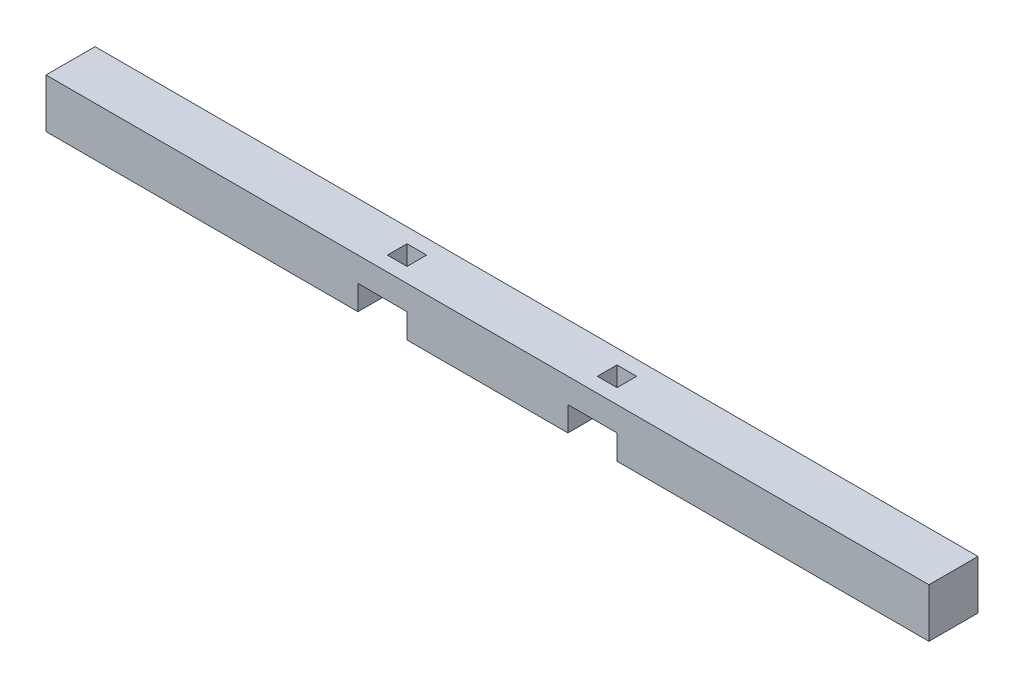
from build123d import *

# Parameters (mm, degrees)
SKETCH1_W           = 25
SKETCH1_H           = 25
BOSS_EXTRUDE1_DEPTH = 450
SKETCH2_W           = 10
SKETCH2_H           = 10
CUT_EXTRUDE1_DEPTH  = 452.386752132
SKETCH3_W           = 25
SKETCH3_H           = 25
CUT_EXTRUDE2_DEPTH  = 12.5


with BuildPart() as part:
    # Sketch1 → Boss-Extrude1 (new body)
    with BuildSketch(Plane(origin=(0, 0, 0), x_dir=(0, 0, -1), z_dir=(1, 0, 0))):
        with Locations((12.5, 12.5)):
            Rectangle(SKETCH1_W, SKETCH1_H)
    extrude(amount=BOSS_EXTRUDE1_DEPTH)

    # Sketch2 → Cut-Extrude1 (cut, through all)
    with BuildSketch(Plane(origin=(0, 25, 0), x_dir=(1, 0, 0), z_dir=(0, 1, 0))):
        with Locations((278.5, 12.5)):
            Rectangle(SKETCH2_W, SKETCH2_H)
        with Locations((171.5, 12.5)):
            Rectangle(SKETCH2_W, SKETCH2_H)
    extrude(amount=-CUT_EXTRUDE1_DEPTH, mode=Mode.SUBTRACT)

    # Sketch3 → Cut-Extrude2 (cut)
    with BuildSketch(Plane.XZ):
        with Locations((278.5, -12.5)):
            Rectangle(SKETCH3_W, SKETCH3_H)
        with Locations((171.5, -12.5)):
            Rectangle(SKETCH3_W, SKETCH3_H)
    extrude(amount=-CUT_EXTRUDE2_DEPTH, mode=Mode.SUBTRACT)


solid = part.part
